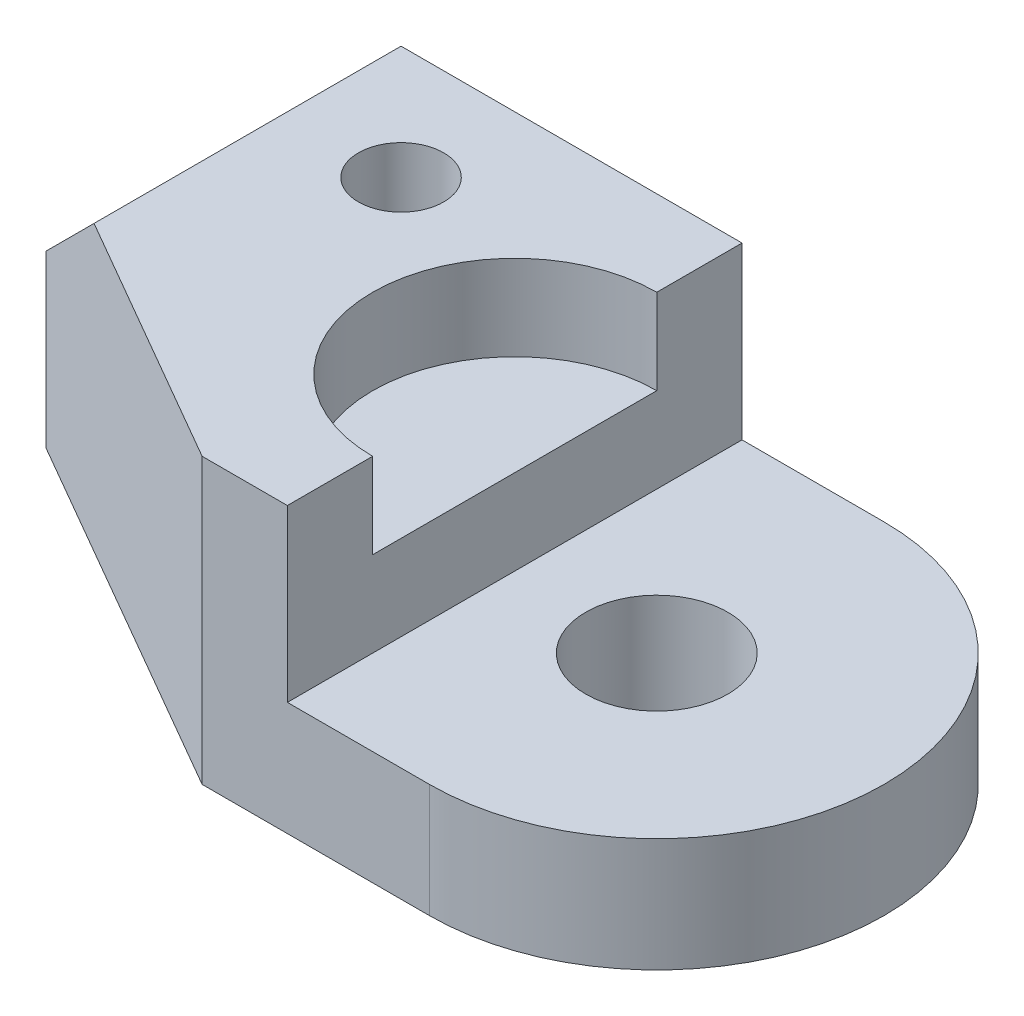
from build123d import *

# Parameters (mm, degrees)
BOSS_EXTRUDE1_DEPTH     = 63.5
CUT_EXTRUDE1_DEPTH      = 157.189348228
CUT_EXTRUDE1_DEPTH_BACK = 38.1
CUT_EXTRUDE2_DEPTH      = 157.189348228
CUT_EXTRUDE3_DEPTH      = 180.268046511
SKETCH5_R               = 31.75
CUT_EXTRUDE4_DEPTH      = 19.05
SKETCH6_R               = 9.525
CUT_EXTRUDE5_DEPTH      = 157.189348228
SKETCH7_R               = 15.875
CUT_EXTRUDE6_DEPTH      = 148.69723254


with BuildPart() as part:
    # Sketch1 → Boss-Extrude1 (new body)
    with BuildSketch(Plane(origin=(0, 0, 0), x_dir=(1, 0, 0), z_dir=(0, 1, 0))):
        with BuildLine():
            Line((0, -50.8), (-133.35, -50.8))
            Line((-133.35, -50.8), (-133.35, 50.8))
            Line((-133.35, 50.8), (0, 50.8))
            ThreePointArc((0, 50.8), (50.8, 0), (0, -50.8))
        make_face()
    extrude(amount=BOSS_EXTRUDE1_DEPTH)

    # Sketch2 → Cut-Extrude1 (cut, two sides: drawn at the far end of the back side and taken through both)
    with BuildSketch(Plane(origin=(0, 63.5, 0), x_dir=(1, 0, 0), z_dir=(0, 1, 0)).offset(-CUT_EXTRUDE1_DEPTH_BACK)):
        Polygon((-31.75, 348.168195874), (-31.75, 50.8), (-31.75, -50.8), (-31.75, -348.168195874), (562.986391748, -348.168195874), (562.986391748, 348.168195874), align=None)
    extrude(amount=CUT_EXTRUDE1_DEPTH + CUT_EXTRUDE1_DEPTH_BACK, mode=Mode.SUBTRACT)

    # Sketch3 → Cut-Extrude2 (cut, through all)
    with BuildSketch(Plane(origin=(0, 63.5, 0), x_dir=(1, 0, 0), z_dir=(0, 1, 0))):
        Polygon((-133.35, -50.8), (-50.8, -50.8), (-133.35, -3.139735278), align=None)
    extrude(amount=-CUT_EXTRUDE2_DEPTH, mode=Mode.SUBTRACT)

    # Sketch4 → Cut-Extrude3 (cut, through all)
    with BuildSketch(Plane(origin=(0, 0, -50.8), x_dir=(-1, 0, 0), z_dir=(0, 0, -1))):
        Polygon((133.35, 63.5), (107.95, 63.5), (133.35, 38.1), align=None)
    extrude(amount=-CUT_EXTRUDE3_DEPTH, mode=Mode.SUBTRACT)

    # Sketch5 → Cut-Extrude4 (cut)
    with BuildSketch(Plane(origin=(0, 63.5, 0), x_dir=(1, 0, 0), z_dir=(0, 1, 0))):
        with Locations((-31.75, 0)):
            Circle(SKETCH5_R)
    extrude(amount=-CUT_EXTRUDE4_DEPTH, mode=Mode.SUBTRACT)

    # Sketch6 → Cut-Extrude5 (cut, through all)
    with BuildSketch(Plane(origin=(0, 63.5, 0), x_dir=(1, 0, 0), z_dir=(0, 1, 0))):
        with Locations(Location((-82.55, 25.4, 0), (0, 0, 270))):
            Circle(SKETCH6_R)
    extrude(amount=-CUT_EXTRUDE5_DEPTH, mode=Mode.SUBTRACT)

    # Sketch7 → Cut-Extrude6 (cut, through all)
    with BuildSketch(Plane(origin=(0, 25.4, 0), x_dir=(1, 0, 0), z_dir=(0, 1, 0))):
        with Locations(Location((0, 0, 0), (0, 0, 270))):
            Circle(SKETCH7_R)
    extrude(amount=-CUT_EXTRUDE6_DEPTH, mode=Mode.SUBTRACT)


solid = part.part
